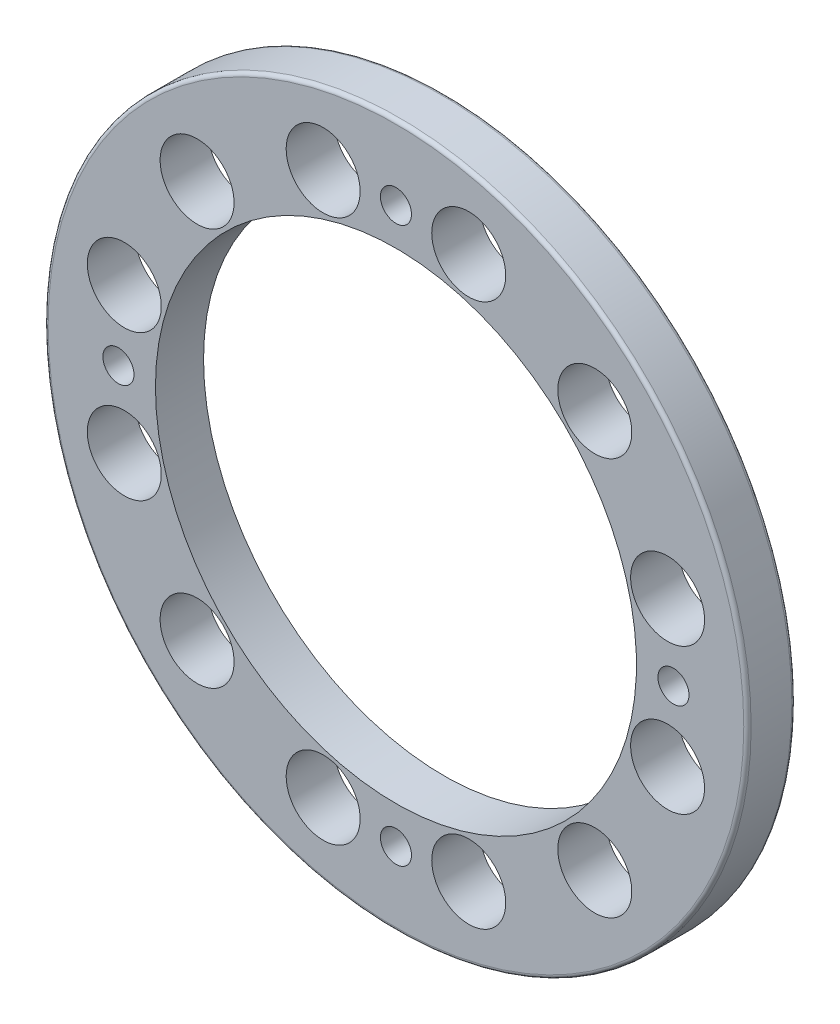
from build123d import *

# Parameters (mm, degrees)
SKETCH1_R             = 47.5
SKETCH1_R_2           = 32.5
BOSS_EXTRUDE1_DEPTH   = 6.5
SKETCH2_R             = 5
CUT_EXTRUDE1_DEPTH    = 68.488887974
M5X0_8_TAPPED_HOLE1_D = 4.2
FILLET1_R             = 0.5


with BuildPart() as part:
    # Sketch1 → Boss-Extrude1 (new body)
    with BuildSketch(Plane.XY):
        with Locations(Location((0, 0, 0), (0, 0, 180))):
            Circle(SKETCH1_R)
        with Locations(Location((0, 0, 0), (0, 0, 180))):
            Circle(SKETCH1_R_2, mode=Mode.SUBTRACT)
    extrude(amount=BOSS_EXTRUDE1_DEPTH)

    # Sketch2 → Cut-Extrude1 (cut, through all)
    with BuildSketch(Plane.XY):
        with Locations(Location((9.835123714, 36.705181399, 0), (0, 0, 180))):
            Circle(SKETCH2_R)
        with Locations(Location((26.870057685, 26.870057685, 0), (0, 0, 180))):
            Circle(SKETCH2_R)
        with Locations(Location((36.705181399, 9.835123714, 0), (0, 0, 180))):
            Circle(SKETCH2_R)
        with Locations(Location((36.705181399, -9.835123714, 0), (0, 0, 180))):
            Circle(SKETCH2_R)
        with Locations(Location((26.870057685, -26.870057685, 0), (0, 0, 180))):
            Circle(SKETCH2_R)
        with Locations(Location((9.835123714, -36.705181399, 0), (0, 0, 180))):
            Circle(SKETCH2_R)
        with Locations(Location((-9.835123714, -36.705181399, 0), (0, 0, 180))):
            Circle(SKETCH2_R)
        with Locations(Location((-26.870057685, -26.870057685, 0), (0, 0, 180))):
            Circle(SKETCH2_R)
        with Locations(Location((-36.705181399, -9.835123714, 0), (0, 0, 180))):
            Circle(SKETCH2_R)
        with Locations(Location((-36.705181399, 9.835123714, 0), (0, 0, 180))):
            Circle(SKETCH2_R)
        with Locations(Location((-26.870057685, 26.870057685, 0), (0, 0, 180))):
            Circle(SKETCH2_R)
        with Locations(Location((-9.835123714, 36.705181399, 0), (0, 0, 180))):
            Circle(SKETCH2_R)
    extrude(amount=CUT_EXTRUDE1_DEPTH, mode=Mode.SUBTRACT)

    # M5x0.8 Tapped Hole1 (through all)
    with Locations(Plane.XY.offset(6.5)):
        with Locations((0, 37.5), (-37.5, 0), (37.5, 0), (0, -37.5)):
            Hole(M5X0_8_TAPPED_HOLE1_D / 2)

    # Fillet1
    fillet1_edges = [part.edges().sort_by_distance(p)[0] for p in [
        (47.5, 0, 0),
        (47.5, 0, 6.5),
    ]]
    fillet(fillet1_edges, radius=FILLET1_R)


solid = part.part
